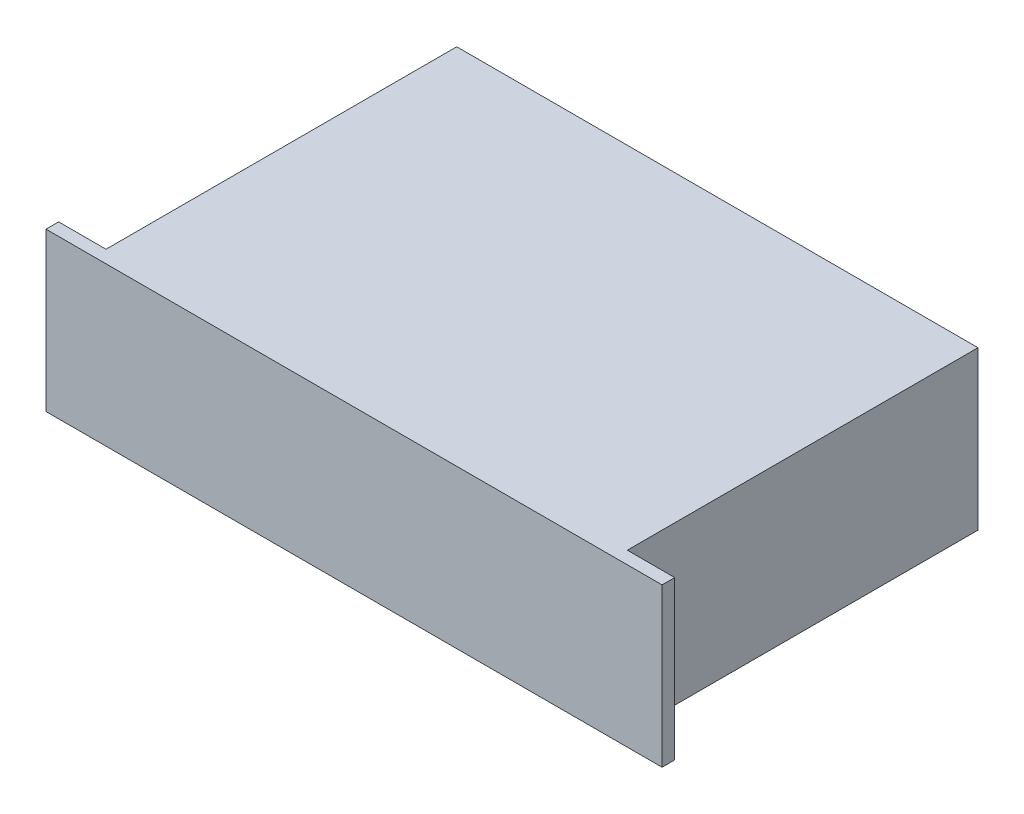
from build123d import *

# Parameters (mm, degrees)
CROQUIS1_W              = 195
CROQUIS1_H              = 50
SALIENTE_EXTRUIR1_DEPTH = 4
CROQUIS2_W              = 165
CROQUIS2_H              = 50
SALIENTE_EXTRUIR2_DEPTH = 111
CROQUIS3_W              = 90.257394992
CROQUIS3_H              = 11.130396244
CORTAR_EXTRUIR1_DEPTH   = 10


with BuildPart() as part:
    # Croquis1 → Saliente-Extruir1 (new body)
    with BuildSketch(Plane.XY):
        with Locations((97.5, -25)):
            Rectangle(CROQUIS1_W, CROQUIS1_H)
    extrude(amount=SALIENTE_EXTRUIR1_DEPTH)

    # Croquis2 → Saliente-Extruir2 (add)
    with BuildSketch(Plane(origin=(0, 0, 0), x_dir=(-1, 0, 0), z_dir=(0, 0, -1))):
        with Locations((-97.5, -25)):
            Rectangle(CROQUIS2_W, CROQUIS2_H)
    extrude(amount=SALIENTE_EXTRUIR2_DEPTH)

    # Croquis3 → Cortar-Extruir1 (cut)
    with BuildSketch(Plane(origin=(0, 0, -111), x_dir=(-1, 0, 0), z_dir=(0, 0, -1))):
        with Locations((-97.5, -25)):
            Rectangle(CROQUIS3_W, CROQUIS3_H)
    extrude(amount=-CORTAR_EXTRUIR1_DEPTH, mode=Mode.SUBTRACT)


solid = part.part
